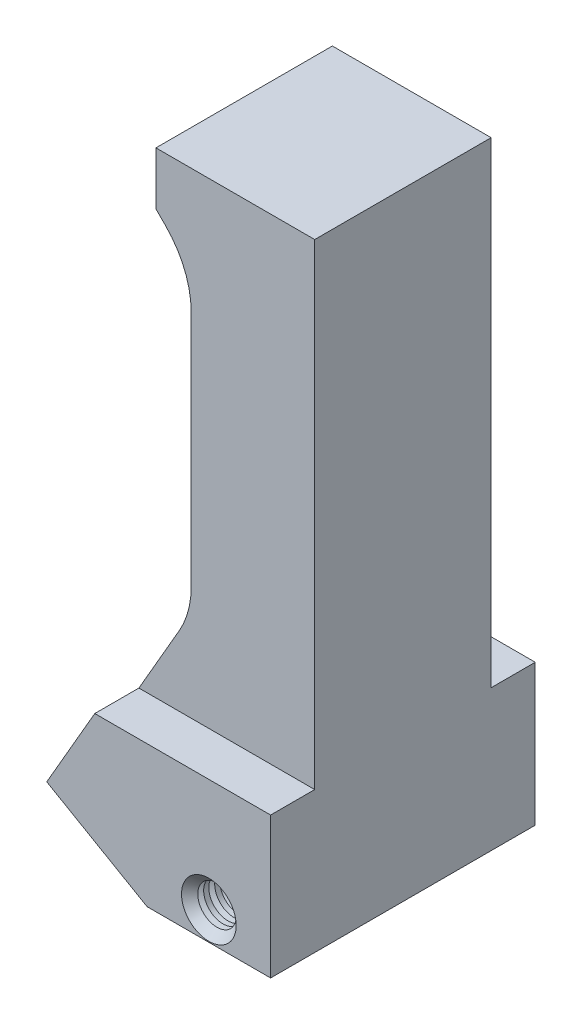
from build123d import *

# Parameters (mm, degrees)
BOSS_EXTRUDE1_DEPTH             = 9.525
F_70_0_028_DIAMETER_HOLE1_D     = 0.7112
F_70_0_028_DIAMETER_HOLE1_DEPTH = 2.413
F_70_0_028_DIAMETER_HOLE1_TIP   = 0.213666036
FILLET5_R                       = 6.35
SKETCH90_W                      = 3.175
SKETCH90_H                      = 34.29
CUT_EXTRUDE5_DEPTH              = 49.230860727


with BuildPart() as part:
    # Sketch3 → Boss-Extrude1 (new, symmetric)
    with BuildSketch(Plane.XY):
        Polygon((0, 0), (0, 44.45), (-8.89, 44.45), (-11.43, 44.45), (-11.43, 40.64), (-8.89, 38.1), (-8.89, 16.68503416), (-16.114831723, 4.17125854), (-8.89, 0), align=None)
    extrude(amount=BOSS_EXTRUDE1_DEPTH, both=True)

    # Sketch5 → UPCHURCH 6-32 CONE (revolve, cut)
    with BuildSketch(Plane(origin=(-4.445, 25.259183771, 8.769011984), x_dir=(0, -0.8515022287907943, 0.52435098394521), z_dir=(-1, 0, 0))):
        Polygon((15.292959977, -18.808573968), (15.757749291, -16.067720643), (16.864704876, -14.270117175), (16.687021127, -14.160700376), (16.599421786, -13.998522648), (17.024527056, -14.010579296), (17.217736651, -13.696823041), (17.015625379, -13.322642754), (17.440730649, -13.334699402), (17.633940244, -13.020943147), (17.431828973, -12.64676286), (17.856934243, -12.658819508), (18.050143838, -12.345063253), (17.848032566, -11.970882966), (18.273137836, -11.982939614), (18.466347431, -11.669183359), (18.26423616, -11.295003072), (18.68934143, -11.30705972), (18.498219672, -10.503286273), (20.17440181, -11.535471185), (15.113366113, -19.754170697), (14.821385998, -19.574370744), align=None)
    upchurch_6_32_cone = revolve(axis=Axis((-4.445, 2.032, -2.119740469), (0, 0, 1)), mode=Mode.SUBTRACT)

    # Mirror1: UPCHURCH 6-32 CONE across plane
    add(upchurch_6_32_cone.mirror(Plane.XY), mode=Mode.SUBTRACT)

    # Sketch52 → UPCHURCH 10-32 CONE (revolve, cut)
    with BuildSketch(Plane(origin=(-19.421374868, 2.468387248, 20.886307367), x_dir=(-0.22324939894345092, 0.4655392731409244, -0.8564069657790084), z_dir=(0.47332472697656286, 0.8198224756020795, 0.32226512583622835)), mode=Mode.PRIVATE) as upchurch_10_32_cone_sk:
        Polygon((13.895467161, -20.280398331), (14.632657074, -18.71527204), (14.83876907, -16.459597929), (14.558395769, -16.101111936), (15.153942241, -14.836708527), (15.004691459, -14.766409937), (15.194529151, -14.750538548), (15.345290492, -14.430457474), (15.094342029, -14.069108794), (15.532753397, -14.03245539), (15.683514739, -13.712374317), (15.432566276, -13.351025636), (15.870977644, -13.314372232), (16.021738986, -12.994291159), (15.770790523, -12.632942478), (16.209201891, -12.596289075), (16.359963233, -12.276208001), (16.10901477, -11.914859321), (16.547426138, -11.878205917), (16.698187479, -11.558124844), (16.447239017, -11.196776163), (16.885650385, -11.16012276), (16.460208405, -9.977058466), (19.102754425, -11.221723695), (14.665252306, -20.642974723), align=None)
    revolve(upchurch_10_32_cone_sk.sketch.rotate(Axis((-5.104911358, 2.413, 0), (-0.86602540378444, 0.49999999999999756, 0)), 108.799965538), axis=Axis((-5.104911358, 2.413, 0), (-0.86602540378444, 0.49999999999999756, 0)), mode=Mode.SUBTRACT)

    # #70 (0.028) Diameter Hole1
    with Locations(Plane(origin=(-4.873543168, 2.81374146, 0), x_dir=(0.49999999999999745, 0.86602540378444, 0), z_dir=(-0.8660254037844402, 0.4999999999999975, 0))):
        with Locations((-0.46273638, 0)):
            Hole(F_70_0_028_DIAMETER_HOLE1_D / 2, depth=F_70_0_028_DIAMETER_HOLE1_DEPTH)
            with Locations((0, 0, -(F_70_0_028_DIAMETER_HOLE1_DEPTH + F_70_0_028_DIAMETER_HOLE1_TIP / 2))):  # 118° drill point
                Cone(0, F_70_0_028_DIAMETER_HOLE1_D / 2, F_70_0_028_DIAMETER_HOLE1_TIP, mode=Mode.SUBTRACT)

    # Fillet5
    fillet5_edges = [part.edges().sort_by_distance(p)[0] for p in [
        (-8.89, 16.68503416, 0),
        (-8.89, 38.1, 0),
    ]]
    fillet(fillet5_edges, radius=FILLET5_R)

    # Sketch90 → Cut-Extrude5 (cut, through all)
    with BuildSketch(Plane(origin=(0, 0, 0), x_dir=(0, 0, -1), z_dir=(1, 0, 0))):
        with Locations((-7.9375, 27.305)):
            Rectangle(SKETCH90_W, SKETCH90_H)
        with Locations((7.9375, 27.305)):
            Rectangle(SKETCH90_W, SKETCH90_H)
    extrude(amount=-CUT_EXTRUDE5_DEPTH, mode=Mode.SUBTRACT)


solid = part.part
